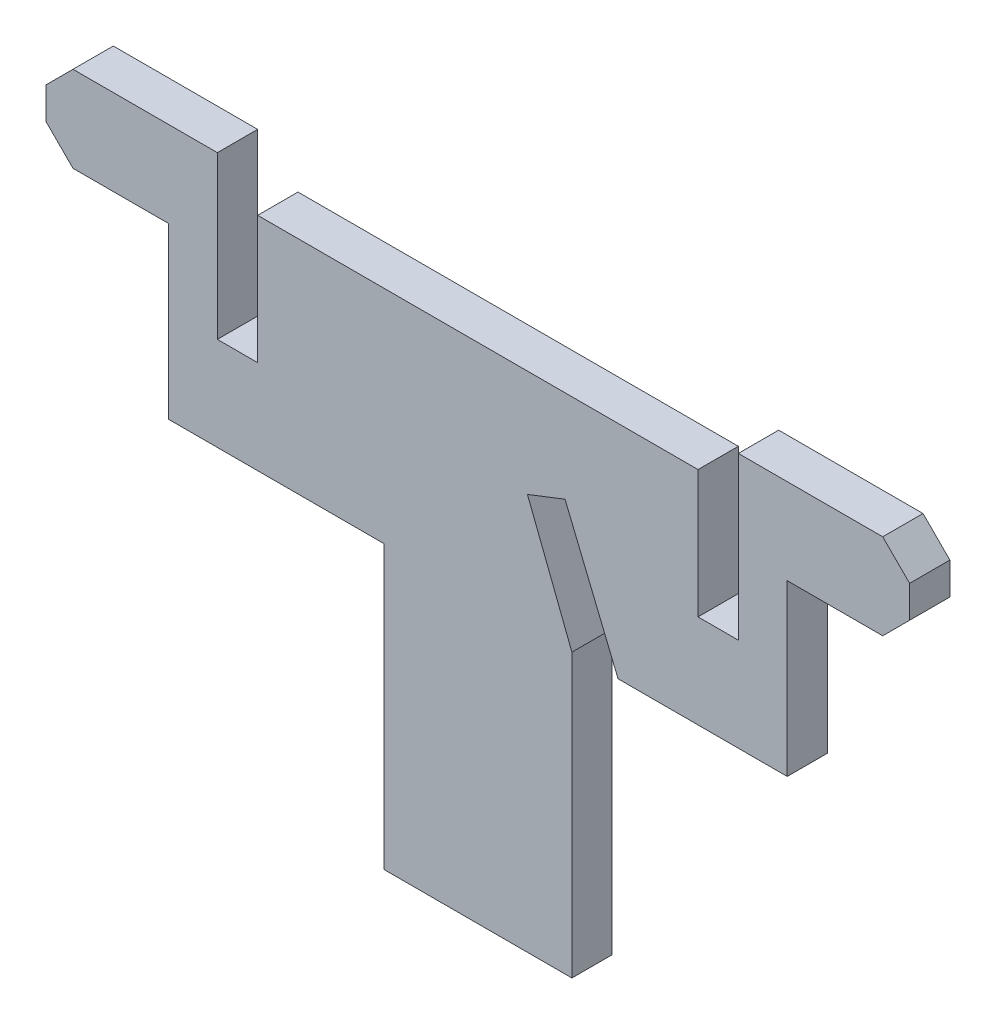
from build123d import *

# Parameters (mm, degrees)
BASE_EXTRUDE_DEPTH = 3


with BuildPart() as part:
    # Sketch1 → Base-Extrude (new body)
    with BuildSketch(Plane.XY):
        Polygon((507.382666582, -79.163801432), (509.382666582, -81.163801432), (509.382666582, -83.546103264), (507.382666582, -85.546103264), (500.276789321, -85.546103264), (500.276789321, -98.16400177), (487.686287766, -98.16400177), (483.740648064, -88.564860259), (480.944444947, -89.651712655), (484.253075056, -98.16400177), (484.253075056, -119.16400177), (470.253075056, -119.16400177), (470.253075056, -98.16400177), (454.229360791, -98.16400177), (454.229360791, -85.546103264), (447.123483531, -85.546103264), (445.123483531, -83.546103264), (445.123483531, -81.163801432), (447.123483531, -79.163801432), (457.868075056, -79.163801432), (457.868075056, -91.198985184), (460.868075056, -91.198985184), (460.868075056, -81.703167502), (493.638075056, -81.703167502), (493.638075056, -91.198985184), (496.638075056, -91.198985184), (496.638075056, -79.163801432), align=None)
    extrude(amount=BASE_EXTRUDE_DEPTH)


solid = part.part
